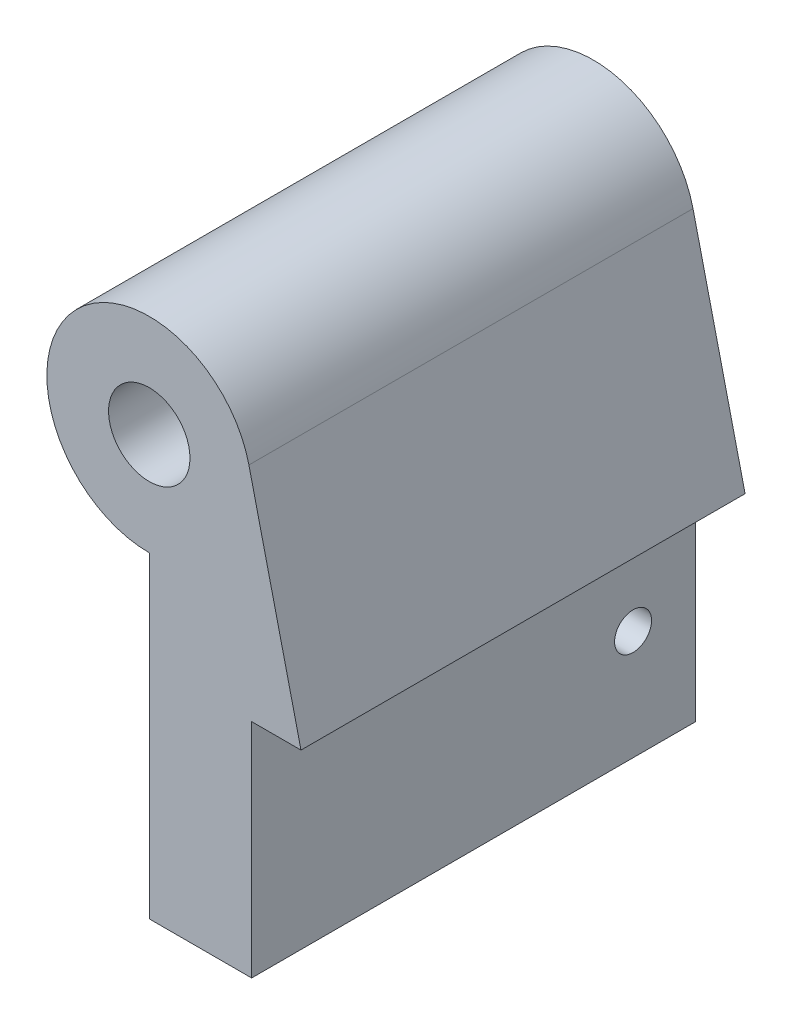
from build123d import *

# Parameters (mm, degrees)
ESQUISSE1_R             = 1.65
BOSS_EXTRU_1_DEPTH      = 9
ESQUISSE3_R             = 0.75
ENL_V_MAT_EXTRU_2_DEPTH = 21.949701669


with BuildPart() as part:
    # Esquisse1 → Boss.-Extru.1 (new, symmetric)
    with BuildSketch(Plane.XY):
        with BuildLine():
            Line((0, -4.15), (0, -17))
            Line((0, -17), (4.15, -17))
            Line((4.15, -17), (4.15, -8))
            Line((4.15, -8), (6.15, -8))
            Line((6.15, -8), (4.039246655, 0.952358366))
            ThreePointArc((4.039246655, 0.952358366), (-3.253827532, 2.575870026), (0, -4.15))
        make_face()
        Circle(ESQUISSE1_R, mode=Mode.SUBTRACT)
    extrude(amount=BOSS_EXTRU_1_DEPTH, both=True)

    # Esquisse3 → Enlèv. mat.-Extru.2 (cut, through all)
    with BuildSketch(Plane(origin=(4.15, 0, 0), x_dir=(0, 0, -1), z_dir=(1, 0, 0))):
        with Locations((6.46, -12.555)):
            Circle(ESQUISSE3_R)
    extrude(amount=-ENL_V_MAT_EXTRU_2_DEPTH, mode=Mode.SUBTRACT)


solid = part.part
